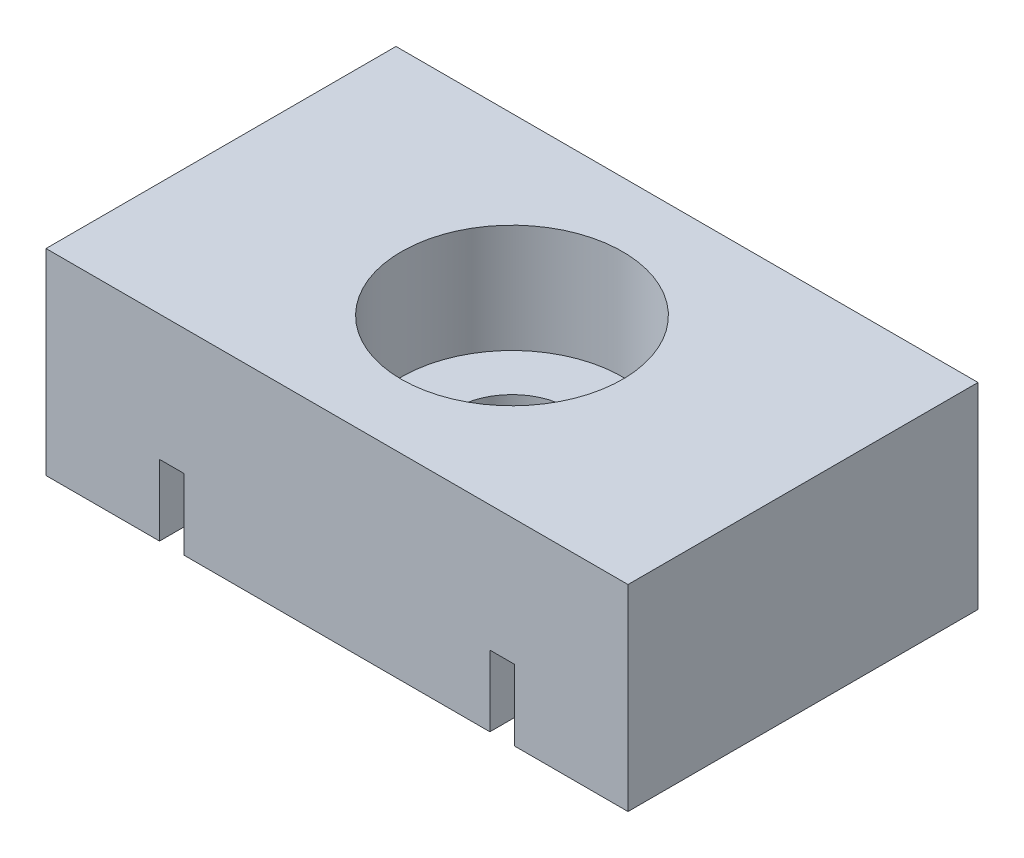
from build123d import *

# Parameters (mm, degrees)
SKETCH1_W               = 18.796
SKETCH1_H               = 11.303
BASE_DEPTH              = 6.35
BOXSLOTS_DEPTH          = 2.286
MOUTINGHOLE_D           = 3.6576
MOUTINGHOLE_CBORE_D     = 7.14502
MOUTINGHOLE_CBORE_DEPTH = 3.5052


with BuildPart() as part:
    # Sketch1 → Base (new body)
    with BuildSketch(Plane(origin=(0, 0, 0), x_dir=(1, 0, 0), z_dir=(0, 1, 0))):
        Rectangle(SKETCH1_W, SKETCH1_H)
    extrude(amount=BASE_DEPTH)

    # Sketch2 → BoxSlots (cut)
    with BuildSketch(Plane.XZ):
        with BuildLine():
            Line((-4.937125, 5.6515), (-4.937125, 4.1783))
            ThreePointArc((-4.937125, 4.1783), (-5.334, 3.781425), (-5.730875, 4.1783))
            Line((-5.730875, 4.1783), (-5.730875, 5.6515))
            ThreePointArc((-5.730875, 5.6515), (-5.334, 6.048375), (-4.937125, 5.6515))
        make_face()
        with BuildLine():
            Line((5.730875, 5.6515), (5.730875, 4.1783))
            ThreePointArc((5.730875, 4.1783), (5.334, 3.781425), (4.937125, 4.1783))
            Line((4.937125, 4.1783), (4.937125, 5.6515))
            ThreePointArc((4.937125, 5.6515), (5.334, 6.048375), (5.730875, 5.6515))
        make_face()
    extrude(amount=-BOXSLOTS_DEPTH, mode=Mode.SUBTRACT)

    # MoutingHole (through all)
    with Locations(Plane(origin=(0, 6.35, 0), x_dir=(1, 0, 0), z_dir=(0, 1, 0))):
        with Locations((0, 0)):
            CounterBoreHole(MOUTINGHOLE_D / 2, MOUTINGHOLE_CBORE_D / 2, MOUTINGHOLE_CBORE_DEPTH)


solid = part.part
